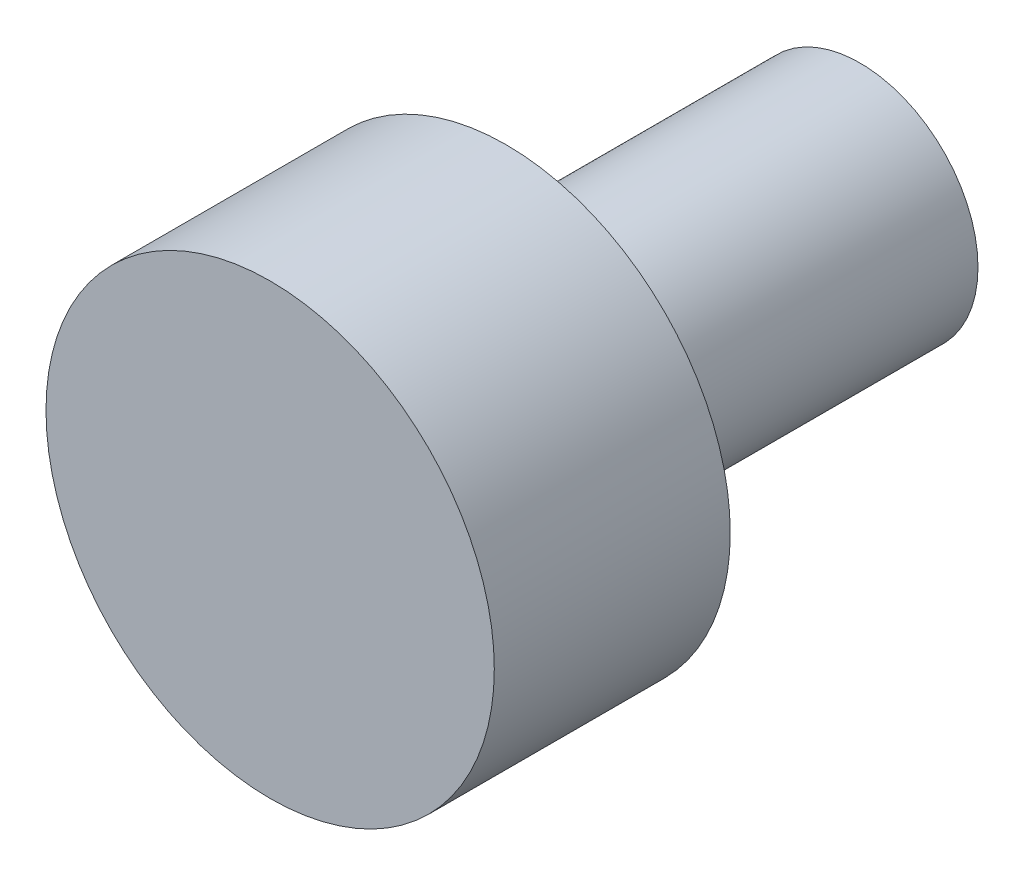
from build123d import *

# Parameters (mm, degrees)
THREAD_ENVELOPE_START = -3
SKETCH1_R             = 1
THREAD_ENVELOPE_DEPTH = 3
SKETCH2_R             = 1.9
HEAD_ENVELOPE_DEPTH   = 2


with BuildPart() as part:
    # Sketch1 → Thread_Envelope (new body)
    with BuildSketch(Plane.XY.offset(THREAD_ENVELOPE_START)):
        Circle(SKETCH1_R)
    extrude(amount=THREAD_ENVELOPE_DEPTH)

    # Sketch2 → Head_Envelope (add)
    with BuildSketch(Plane.XY):
        Circle(SKETCH2_R)
    extrude(amount=HEAD_ENVELOPE_DEPTH)


solid = part.part
